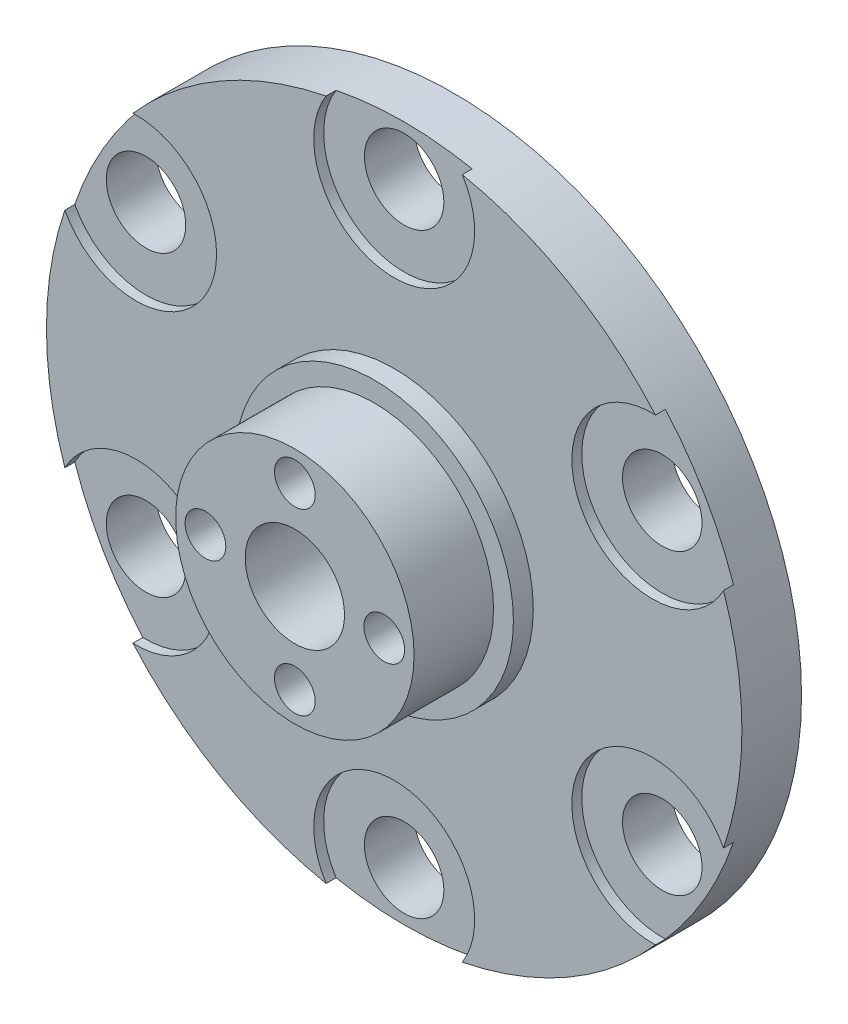
from build123d import *

# Parameters (mm, degrees)
SKETCH_1_R          = 17.5
SKETCH_1_R_2        = 2.5
SKETCH_1_R_3        = 2
EXTRUDE_1_DEPTH     = 3
SKETCH_2_R          = 6
SKETCH_2_R_2        = 2.5
EXTRUDE_2_DEPTH     = 5
SKETCH_4_R          = 4.05
CUT_EXTRUDE_2_DEPTH = 0.5
SKETCH_5_R          = 1.025
CUT_EXTRUDE_3_DEPTH = 5
SKETCH_6_R          = 7
SKETCH_6_R_2        = 5.979713823
EXTRUDE_4_DEPTH     = 1


with BuildPart() as part:
    # 草图1 → 凸台-拉伸1 (new body)
    with BuildSketch(Plane.XY):
        Circle(SKETCH_1_R)
        Circle(SKETCH_1_R_2, mode=Mode.SUBTRACT)
        with Locations((0, 15)):
            Circle(SKETCH_1_R_3, mode=Mode.SUBTRACT)
        with Locations((12.990381057, 7.5)):
            Circle(SKETCH_1_R_3, mode=Mode.SUBTRACT)
        with Locations((12.990381057, -7.5)):
            Circle(SKETCH_1_R_3, mode=Mode.SUBTRACT)
        with Locations((0, -15)):
            Circle(SKETCH_1_R_3, mode=Mode.SUBTRACT)
        with Locations((-12.990381057, -7.5)):
            Circle(SKETCH_1_R_3, mode=Mode.SUBTRACT)
        with Locations((-12.990381057, 7.5)):
            Circle(SKETCH_1_R_3, mode=Mode.SUBTRACT)
    extrude(amount=EXTRUDE_1_DEPTH)

    # 草图2 → 凸台-拉伸2 (add)
    with BuildSketch(Plane.XY.offset(3)):
        Circle(SKETCH_2_R)
        Circle(SKETCH_2_R_2, mode=Mode.SUBTRACT)
    extrude(amount=EXTRUDE_2_DEPTH)

    # 草图4 → 切除-拉伸2 (cut)
    with BuildSketch(Plane.XY.offset(3)):
        with Locations((12.990381057, 7.5)):
            Circle(SKETCH_4_R)
        with Locations((12.990381057, -7.5)):
            Circle(SKETCH_4_R)
        with Locations((0, -15)):
            Circle(SKETCH_4_R)
        with Locations((-12.990381057, -7.5)):
            Circle(SKETCH_4_R)
        with Locations((-12.990381057, 7.5)):
            Circle(SKETCH_4_R)
        with Locations((0, 15)):
            Circle(SKETCH_4_R)
    extrude(amount=-CUT_EXTRUDE_2_DEPTH, mode=Mode.SUBTRACT)

    # 草图5 → 切除-拉伸3 (cut)
    with BuildSketch(Plane.XY.offset(8)):
        with Locations((0, 4.5)):
            Circle(SKETCH_5_R)
        with Locations((4.5, 0)):
            Circle(SKETCH_5_R)
        with Locations((0, -4.5)):
            Circle(SKETCH_5_R)
        with Locations((-4.5, 0)):
            Circle(SKETCH_5_R)
    extrude(amount=-CUT_EXTRUDE_3_DEPTH, mode=Mode.SUBTRACT)

    # 草图6 → 凸台-拉伸4 (add)
    with BuildSketch(Plane.XY.offset(3)):
        Circle(SKETCH_6_R)
        Circle(SKETCH_6_R_2, mode=Mode.SUBTRACT)
    extrude(amount=EXTRUDE_4_DEPTH)


solid = part.part
